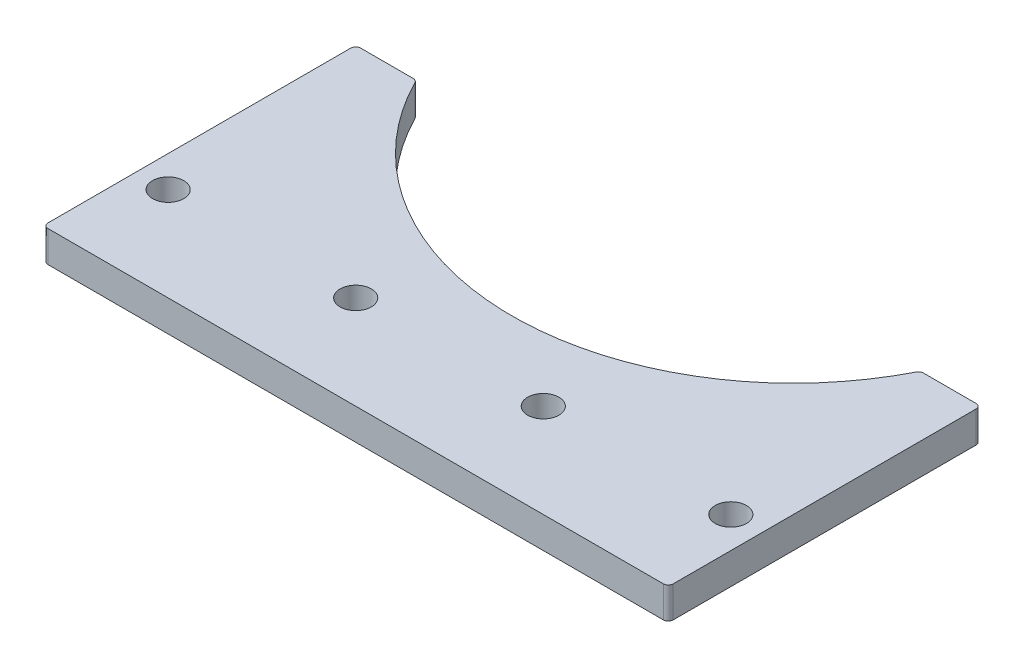
from build123d import *

# Parameters (mm, degrees)
BOSS_EXTRUDE1_DEPTH = 6.35
SKETCH2_R           = 3.175
CUT_EXTRUDE1_DEPTH  = 110.433918417
FILLET1_R           = 1


with BuildPart() as part:
    # Sketch1 → Boss-Extrude1 (new body)
    with BuildSketch(Plane(origin=(0, 0, 0), x_dir=(1, 0, 0), z_dir=(0, 1, 0))):
        with BuildLine():
            Line((51.195336702, -25.4), (63.5, -25.4))
            Line((63.5, -25.4), (63.5, -88.9))
            Line((63.5, -88.9), (-63.5, -88.9))
            Line((-63.5, -88.9), (-63.5, -25.4))
            Line((-63.5, -25.4), (-51.195336702, -25.4))
            ThreePointArc((-51.195336702, -25.4), (0, -57.15), (51.195336702, -25.4))
        make_face()
    extrude(amount=BOSS_EXTRUDE1_DEPTH)

    # Sketch2 → Cut-Extrude1 (cut, through all)
    with BuildSketch(Plane(origin=(0, 6.35, 0), x_dir=(-1, 0, 0), z_dir=(0, 1, 0))):
        with Locations(Location((19.05, 69.85, 0), (0, 0, 90))):
            Circle(SKETCH2_R)
        with Locations(Location((-19.05, 69.85, 0), (0, 0, 270))):
            Circle(SKETCH2_R)
        with Locations(Location((-57.15, 69.85, 0), (0, 0, 90))):
            Circle(SKETCH2_R)
        with Locations(Location((57.15, 69.85, 0), (0, 0, 270))):
            Circle(SKETCH2_R)
    extrude(amount=-CUT_EXTRUDE1_DEPTH, mode=Mode.SUBTRACT)

    # Fillet1
    fillet1_edges = [part.edges().sort_by_distance(p)[0] for p in [
        (-63.5, 3.175, 25.4),
        (-51.195336702, 3.175, 25.4),
        (51.195336702, 3.175, 25.4),
        (63.5, 3.175, 25.4),
        (63.5, 3.175, 88.9),
        (-63.5, 3.175, 88.9),
    ]]
    fillet(fillet1_edges, radius=FILLET1_R)


solid = part.part
